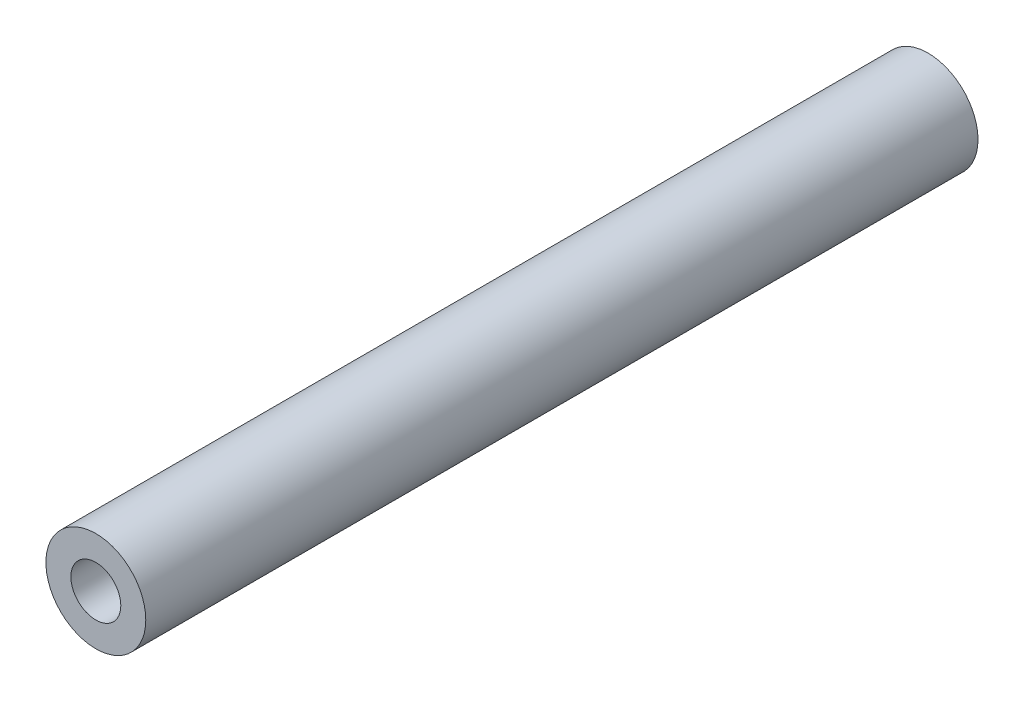
from build123d import *

# Parameters (mm, degrees)
SKETCH1_R           = 6
SKETCH1_R_2         = 3
BOSS_EXTRUDE1_DEPTH = 100


with BuildPart() as part:
    # Sketch1 → Boss-Extrude1 (new body)
    with BuildSketch(Plane.XY):
        Circle(SKETCH1_R)
        Circle(SKETCH1_R_2, mode=Mode.SUBTRACT)
    extrude(amount=BOSS_EXTRUDE1_DEPTH)


solid = part.part
